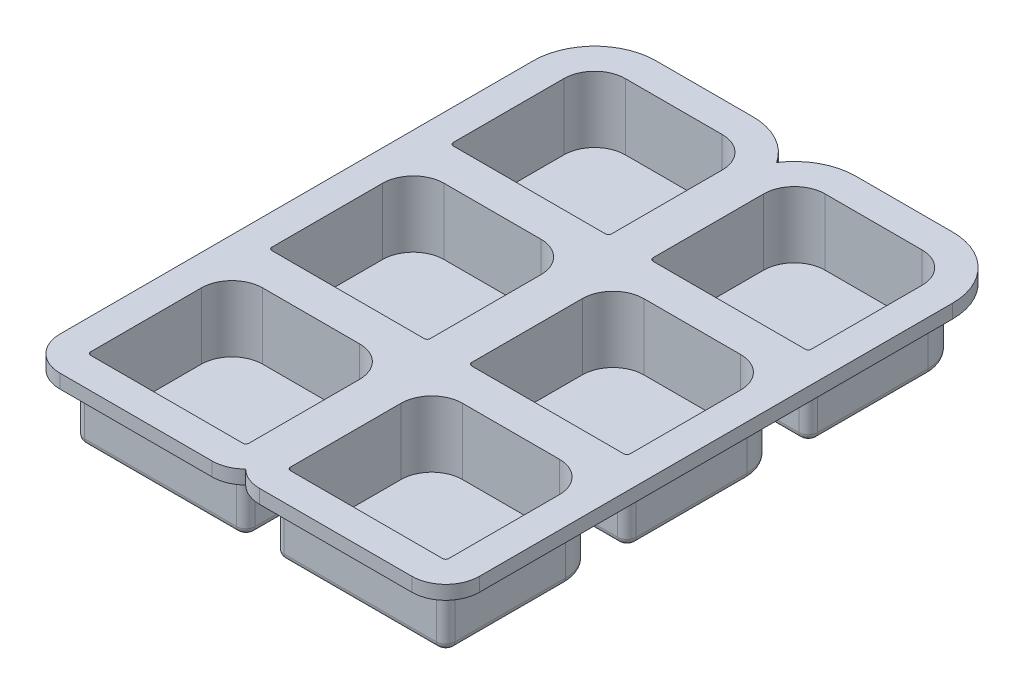
from build123d import *

# Parameters (mm, degrees)
SALIENTE_EXTRUIR1_DEPTH = 21.5
CORTAR_EXTRUIR1_DEPTH   = 17
SALIENTE_EXTRUIR2_START = 3
SALIENTE_EXTRUIR2_DEPTH = 3
REDONDEO2_R             = 2


with BuildPart() as part:
    # Croquis1 → Saliente-Extruir1 (new body)
    with BuildSketch(Plane(origin=(0, 0, 0), x_dir=(1, 0, 0), z_dir=(0, 1, 0))):
        with BuildLine():
            Line((-48.265, 92.5), (-16.735, 92.5))
            ThreePointArc((-16.735, 92.5), (-7.222745757, 90.093095783), (0, 83.451701923))
            ThreePointArc((0, 83.451701923), (7.222745757, 90.093095783), (16.735, 92.5))
            Line((16.735, 92.5), (48.265, 92.5))
            ThreePointArc((48.265, 92.5), (62.407135624, 86.642135624), (68.265, 72.5))
            Line((68.265, 72.5), (68.265, 36.5))
            Line((68.265, 36.5), (68.265, -45.5))
            Line((68.265, -45.5), (68.265, -81.5))
            ThreePointArc((68.265, -81.5), (65.043174593, -89.278174593), (57.265, -92.5))
            Line((57.265, -92.5), (7.735, -92.5))
            ThreePointArc((7.735, -92.5), (3.553625788, -91.674286692), (0, -89.321110855))
            ThreePointArc((0, -89.321110855), (-3.553625788, -91.674286692), (-7.735, -92.5))
            Line((-7.735, -92.5), (-57.265, -92.5))
            ThreePointArc((-57.265, -92.5), (-65.043174593, -89.278174593), (-68.265, -81.5))
            Line((-68.265, -81.5), (-68.265, -45.5))
            Line((-68.265, -45.5), (-68.265, 36.5))
            Line((-68.265, 36.5), (-68.265, 72.5))
            ThreePointArc((-68.265, 72.5), (-62.407135624, 86.642135624), (-48.265, 92.5))
        make_face()
        with BuildLine():
            Line((-48.265, 82.5), (-16.735, 82.5))
            ThreePointArc((-16.735, 82.5), (-9.663932188, 79.571067812), (-6.735, 72.5))
            Line((-6.735, 72.5), (-6.735, 36.5))
            ThreePointArc((-6.735, 36.5), (-7.027893219, 35.792893219), (-7.735, 35.5))
            Line((-7.735, 35.5), (-57.265, 35.5))
            ThreePointArc((-57.265, 35.5), (-57.972106781, 35.792893219), (-58.265, 36.5))
            Line((-58.265, 36.5), (-58.265, 72.5))
            ThreePointArc((-58.265, 72.5), (-55.336067812, 79.571067812), (-48.265, 82.5))
        make_face(mode=Mode.SUBTRACT)
        with BuildLine():
            Line((16.735, 82.5), (48.265, 82.5))
            ThreePointArc((48.265, 82.5), (55.336067812, 79.571067812), (58.265, 72.5))
            Line((58.265, 72.5), (58.265, 36.5))
            ThreePointArc((58.265, 36.5), (57.972106781, 35.792893219), (57.265, 35.5))
            Line((57.265, 35.5), (7.735, 35.5))
            ThreePointArc((7.735, 35.5), (7.027893219, 35.792893219), (6.735, 36.5))
            Line((6.735, 36.5), (6.735, 72.5))
            ThreePointArc((6.735, 72.5), (9.663932188, 79.571067812), (16.735, 82.5))
        make_face(mode=Mode.SUBTRACT)
        with BuildLine():
            Line((16.735, 23.5), (48.265, 23.5))
            ThreePointArc((48.265, 23.5), (55.336067812, 20.571067812), (58.265, 13.5))
            Line((58.265, 13.5), (58.265, -22.5))
            ThreePointArc((58.265, -22.5), (57.972106781, -23.207106781), (57.265, -23.5))
            Line((57.265, -23.5), (7.735, -23.5))
            ThreePointArc((7.735, -23.5), (7.027893219, -23.207106781), (6.735, -22.5))
            Line((6.735, -22.5), (6.735, 13.5))
            ThreePointArc((6.735, 13.5), (9.663932188, 20.571067812), (16.735, 23.5))
        make_face(mode=Mode.SUBTRACT)
        with BuildLine():
            Line((16.735, -35.5), (48.265, -35.5))
            ThreePointArc((48.265, -35.5), (55.336067812, -38.428932188), (58.265, -45.5))
            Line((58.265, -45.5), (58.265, -81.5))
            ThreePointArc((58.265, -81.5), (57.972106781, -82.207106781), (57.265, -82.5))
            Line((57.265, -82.5), (7.735, -82.5))
            ThreePointArc((7.735, -82.5), (7.027893219, -82.207106781), (6.735, -81.5))
            Line((6.735, -81.5), (6.735, -45.5))
            ThreePointArc((6.735, -45.5), (9.663932188, -38.428932188), (16.735, -35.5))
        make_face(mode=Mode.SUBTRACT)
        with BuildLine():
            Line((-48.265, 23.5), (-16.735, 23.5))
            ThreePointArc((-16.735, 23.5), (-9.663932188, 20.571067812), (-6.735, 13.5))
            Line((-6.735, 13.5), (-6.735, -22.5))
            ThreePointArc((-6.735, -22.5), (-7.027893219, -23.207106781), (-7.735, -23.5))
            Line((-7.735, -23.5), (-57.265, -23.5))
            ThreePointArc((-57.265, -23.5), (-57.972106781, -23.207106781), (-58.265, -22.5))
            Line((-58.265, -22.5), (-58.265, 13.5))
            ThreePointArc((-58.265, 13.5), (-55.336067812, 20.571067812), (-48.265, 23.5))
        make_face(mode=Mode.SUBTRACT)
        with BuildLine():
            Line((-48.265, -35.5), (-16.735, -35.5))
            ThreePointArc((-16.735, -35.5), (-9.663932188, -38.428932188), (-6.735, -45.5))
            Line((-6.735, -45.5), (-6.735, -81.5))
            ThreePointArc((-6.735, -81.5), (-7.027893219, -82.207106781), (-7.735, -82.5))
            Line((-7.735, -82.5), (-57.265, -82.5))
            ThreePointArc((-57.265, -82.5), (-57.972106781, -82.207106781), (-58.265, -81.5))
            Line((-58.265, -81.5), (-58.265, -45.5))
            ThreePointArc((-58.265, -45.5), (-55.336067812, -38.428932188), (-48.265, -35.5))
        make_face(mode=Mode.SUBTRACT)
    extrude(amount=SALIENTE_EXTRUIR1_DEPTH)

    # Croquis2 → Cortar-Extruir1 (cut)
    with BuildSketch(Plane.XZ):
        with BuildLine():
            Line((-48.265, -92.5), (-16.735, -92.5))
            ThreePointArc((-16.735, -92.5), (-7.222745757, -90.093095783), (0, -83.451701923))
            ThreePointArc((0, -83.451701923), (7.222745757, -90.093095783), (16.735, -92.5))
            Line((16.735, -92.5), (48.265, -92.5))
            ThreePointArc((48.265, -92.5), (62.407135624, -86.642135624), (68.265, -72.5))
            Line((68.265, -72.5), (68.265, 81.5))
            ThreePointArc((68.265, 81.5), (65.043174593, 89.278174593), (57.265, 92.5))
            Line((57.265, 92.5), (7.735, 92.5))
            ThreePointArc((7.735, 92.5), (3.553625788, 91.674286692), (0, 89.321110855))
            ThreePointArc((0, 89.321110855), (-3.553625788, 91.674286692), (-7.735, 92.5))
            Line((-7.735, 92.5), (-57.265, 92.5))
            ThreePointArc((-57.265, 92.5), (-65.043174593, 89.278174593), (-68.265, 81.5))
            Line((-68.265, 81.5), (-68.265, -72.5))
            ThreePointArc((-68.265, -72.5), (-62.407135624, -86.642135624), (-48.265, -92.5))
        make_face()
        with BuildLine():
            Line((60.265, -72.5), (60.265, -36.5))
            ThreePointArc((60.265, -36.5), (59.386320344, -34.378679656), (57.265, -33.5))
            Line((57.265, -33.5), (7.735, -33.5))
            ThreePointArc((7.735, -33.5), (5.613679656, -34.378679656), (4.735, -36.5))
            Line((4.735, -36.5), (4.735, -72.5))
            ThreePointArc((4.735, -72.5), (8.249718626, -80.985281374), (16.735, -84.5))
            Line((16.735, -84.5), (48.265, -84.5))
            ThreePointArc((48.265, -84.5), (56.750281374, -80.985281374), (60.265, -72.5))
        make_face(mode=Mode.SUBTRACT)
        with BuildLine():
            Line((-4.735, -72.5), (-4.735, -36.5))
            ThreePointArc((-4.735, -36.5), (-5.613679656, -34.378679656), (-7.735, -33.5))
            Line((-7.735, -33.5), (-57.265, -33.5))
            ThreePointArc((-57.265, -33.5), (-59.386320344, -34.378679656), (-60.265, -36.5))
            Line((-60.265, -36.5), (-60.265, -72.5))
            ThreePointArc((-60.265, -72.5), (-56.750281374, -80.985281374), (-48.265, -84.5))
            Line((-48.265, -84.5), (-16.735, -84.5))
            ThreePointArc((-16.735, -84.5), (-8.249718626, -80.985281374), (-4.735, -72.5))
        make_face(mode=Mode.SUBTRACT)
        with BuildLine():
            Line((-48.265, 33.5), (-16.735, 33.5))
            ThreePointArc((-16.735, 33.5), (-8.249718626, 37.014718626), (-4.735, 45.5))
            Line((-4.735, 45.5), (-4.735, 81.5))
            ThreePointArc((-4.735, 81.5), (-5.613679656, 83.621320344), (-7.735, 84.5))
            Line((-7.735, 84.5), (-57.265, 84.5))
            ThreePointArc((-57.265, 84.5), (-59.386320344, 83.621320344), (-60.265, 81.5))
            Line((-60.265, 81.5), (-60.265, 45.5))
            ThreePointArc((-60.265, 45.5), (-56.750281374, 37.014718626), (-48.265, 33.5))
        make_face(mode=Mode.SUBTRACT)
        with BuildLine():
            Line((16.735, 33.5), (48.265, 33.5))
            ThreePointArc((48.265, 33.5), (56.750281374, 37.014718626), (60.265, 45.5))
            Line((60.265, 45.5), (60.265, 81.5))
            ThreePointArc((60.265, 81.5), (59.386320344, 83.621320344), (57.265, 84.5))
            Line((57.265, 84.5), (7.735, 84.5))
            ThreePointArc((7.735, 84.5), (5.613679656, 83.621320344), (4.735, 81.5))
            Line((4.735, 81.5), (4.735, 45.5))
            ThreePointArc((4.735, 45.5), (8.249718626, 37.014718626), (16.735, 33.5))
        make_face(mode=Mode.SUBTRACT)
        with BuildLine():
            Line((-7.735, 25.5), (-57.265, 25.5))
            ThreePointArc((-57.265, 25.5), (-59.386320344, 24.621320344), (-60.265, 22.5))
            Line((-60.265, 22.5), (-60.265, -13.5))
            ThreePointArc((-60.265, -13.5), (-56.750281374, -21.985281374), (-48.265, -25.5))
            Line((-48.265, -25.5), (-16.735, -25.5))
            ThreePointArc((-16.735, -25.5), (-8.249718626, -21.985281374), (-4.735, -13.5))
            Line((-4.735, -13.5), (-4.735, 22.5))
            ThreePointArc((-4.735, 22.5), (-5.613679656, 24.621320344), (-7.735, 25.5))
        make_face(mode=Mode.SUBTRACT)
        with BuildLine():
            Line((57.265, 25.5), (7.735, 25.5))
            ThreePointArc((7.735, 25.5), (5.613679656, 24.621320344), (4.735, 22.5))
            Line((4.735, 22.5), (4.735, -13.5))
            ThreePointArc((4.735, -13.5), (8.249718626, -21.985281374), (16.735, -25.5))
            Line((16.735, -25.5), (48.265, -25.5))
            ThreePointArc((48.265, -25.5), (56.750281374, -21.985281374), (60.265, -13.5))
            Line((60.265, -13.5), (60.265, 22.5))
            ThreePointArc((60.265, 22.5), (59.386320344, 24.621320344), (57.265, 25.5))
        make_face(mode=Mode.SUBTRACT)
    extrude(amount=-CORTAR_EXTRUIR1_DEPTH, mode=Mode.SUBTRACT)

    # Croquis3 → Saliente-Extruir2 (add)
    with BuildSketch(Plane.XZ.offset(SALIENTE_EXTRUIR2_START)):
        with BuildLine():
            Line((60.265, 45.5), (60.265, 81.5))
            ThreePointArc((60.265, 81.5), (59.386320344, 83.621320344), (57.265, 84.5))
            Line((57.265, 84.5), (7.735, 84.5))
            ThreePointArc((7.735, 84.5), (5.613679656, 83.621320344), (4.735, 81.5))
            Line((4.735, 81.5), (4.735, 45.5))
            ThreePointArc((4.735, 45.5), (8.249718626, 37.014718626), (16.735, 33.5))
            Line((16.735, 33.5), (48.265, 33.5))
            ThreePointArc((48.265, 33.5), (56.750281374, 37.014718626), (60.265, 45.5))
        make_face()
        with BuildLine():
            Line((-48.265, 33.5), (-16.735, 33.5))
            ThreePointArc((-16.735, 33.5), (-8.249718626, 37.014718626), (-4.735, 45.5))
            Line((-4.735, 45.5), (-4.735, 81.5))
            ThreePointArc((-4.735, 81.5), (-5.613679656, 83.621320344), (-7.735, 84.5))
            Line((-7.735, 84.5), (-57.265, 84.5))
            ThreePointArc((-57.265, 84.5), (-59.386320344, 83.621320344), (-60.265, 81.5))
            Line((-60.265, 81.5), (-60.265, 45.5))
            ThreePointArc((-60.265, 45.5), (-56.750281374, 37.014718626), (-48.265, 33.5))
        make_face()
        with BuildLine():
            Line((-7.735, 25.5), (-57.265, 25.5))
            ThreePointArc((-57.265, 25.5), (-59.386320344, 24.621320344), (-60.265, 22.5))
            Line((-60.265, 22.5), (-60.265, -13.5))
            ThreePointArc((-60.265, -13.5), (-56.750281374, -21.985281374), (-48.265, -25.5))
            Line((-48.265, -25.5), (-16.735, -25.5))
            ThreePointArc((-16.735, -25.5), (-8.249718626, -21.985281374), (-4.735, -13.5))
            Line((-4.735, -13.5), (-4.735, 22.5))
            ThreePointArc((-4.735, 22.5), (-5.613679656, 24.621320344), (-7.735, 25.5))
        make_face()
        with BuildLine():
            Line((57.265, 25.5), (7.735, 25.5))
            ThreePointArc((7.735, 25.5), (5.613679656, 24.621320344), (4.735, 22.5))
            Line((4.735, 22.5), (4.735, -13.5))
            ThreePointArc((4.735, -13.5), (8.249718626, -21.985281374), (16.735, -25.5))
            Line((16.735, -25.5), (48.265, -25.5))
            ThreePointArc((48.265, -25.5), (56.750281374, -21.985281374), (60.265, -13.5))
            Line((60.265, -13.5), (60.265, 22.5))
            ThreePointArc((60.265, 22.5), (59.386320344, 24.621320344), (57.265, 25.5))
        make_face()
        with BuildLine():
            Line((-7.735, -33.5), (-57.265, -33.5))
            ThreePointArc((-57.265, -33.5), (-59.386320344, -34.378679656), (-60.265, -36.5))
            Line((-60.265, -36.5), (-60.265, -72.5))
            ThreePointArc((-60.265, -72.5), (-56.750281374, -80.985281374), (-48.265, -84.5))
            Line((-48.265, -84.5), (-16.735, -84.5))
            ThreePointArc((-16.735, -84.5), (-8.249718626, -80.985281374), (-4.735, -72.5))
            Line((-4.735, -72.5), (-4.735, -36.5))
            ThreePointArc((-4.735, -36.5), (-5.613679656, -34.378679656), (-7.735, -33.5))
        make_face()
        with BuildLine():
            Line((60.265, -72.5), (60.265, -36.5))
            ThreePointArc((60.265, -36.5), (59.386320344, -34.378679656), (57.265, -33.5))
            Line((57.265, -33.5), (7.735, -33.5))
            ThreePointArc((7.735, -33.5), (5.613679656, -34.378679656), (4.735, -36.5))
            Line((4.735, -36.5), (4.735, -72.5))
            ThreePointArc((4.735, -72.5), (8.249718626, -80.985281374), (16.735, -84.5))
            Line((16.735, -84.5), (48.265, -84.5))
            ThreePointArc((48.265, -84.5), (56.750281374, -80.985281374), (60.265, -72.5))
        make_face()
    extrude(amount=-SALIENTE_EXTRUIR2_DEPTH)

    # Redondeo2
    redondeo2_edges = [part.edges().sort_by_distance(p)[0] for p in [
        (-4.735, 17, -54.5),
        (-5.613679656, 17, -34.378679656),
        (-32.5, 17, -33.5),
        (-59.386320344, 17, -34.378679656),
        (-60.265, 17, -54.5),
        (-56.750281374, 17, -80.985281374),
        (-32.5, 17, -84.5),
        (-8.249718626, 17, -80.985281374),
        (-60.265, 17, 63.5),
        (-56.750281374, 17, 37.014718626),
        (-32.5, 17, 33.5),
        (-8.249718626, 17, 37.014718626),
        (-4.735, 17, 63.5),
        (-5.613679656, 17, 83.621320344),
        (-32.5, 17, 84.5),
        (-59.386320344, 17, 83.621320344),
        (60.265, 17, 4.5),
        (59.386320344, 17, 24.621320344),
        (32.5, 17, 25.5),
        (5.613679656, 17, 24.621320344),
        (4.735, 17, 4.5),
        (8.249718626, 17, -21.985281374),
        (32.5, 17, -25.5),
        (56.750281374, 17, -21.985281374),
        (32.5, 17, 33.5),
        (56.750281374, 17, 37.014718626),
        (60.265, 17, 63.5),
        (59.386320344, 17, 83.621320344),
        (32.5, 17, 84.5),
        (5.613679656, 17, 83.621320344),
        (4.735, 17, 63.5),
        (8.249718626, 17, 37.014718626),
        (-4.735, 17, 4.5),
        (-5.613679656, 17, 24.621320344),
        (-32.5, 17, 25.5),
        (-59.386320344, 17, 24.621320344),
        (-60.265, 17, 4.5),
        (-56.750281374, 17, -21.985281374),
        (-32.5, 17, -25.5),
        (-8.249718626, 17, -21.985281374),
        (32.5, 17, -84.5),
        (56.750281374, 17, -80.985281374),
        (60.265, 17, -54.5),
        (59.386320344, 17, -34.378679656),
        (32.5, 17, -33.5),
        (5.613679656, 17, -34.378679656),
        (4.735, 17, -54.5),
        (8.249718626, 17, -80.985281374),
        (-5.613679656, -3, -34.378679656),
        (-32.5, -3, -33.5),
        (-59.386320344, -3, -34.378679656),
        (-60.265, -3, -54.5),
        (-56.750281374, -3, -80.985281374),
        (-32.5, -3, -84.5),
        (-8.249718626, -3, -80.985281374),
        (-4.735, -3, -54.5),
        (59.386320344, -3, 24.621320344),
        (32.5, -3, 25.5),
        (5.613679656, -3, 24.621320344),
        (4.735, -3, 4.5),
        (8.249718626, -3, -21.985281374),
        (32.5, -3, -25.5),
        (56.750281374, -3, -21.985281374),
        (60.265, -3, 4.5),
        (-5.613679656, -3, 24.621320344),
        (-32.5, -3, 25.5),
        (-59.386320344, -3, 24.621320344),
        (-60.265, -3, 4.5),
        (-56.750281374, -3, -21.985281374),
        (-32.5, -3, -25.5),
        (-8.249718626, -3, -21.985281374),
        (-4.735, -3, 4.5),
        (-56.750281374, -3, 37.014718626),
        (-32.5, -3, 33.5),
        (-8.249718626, -3, 37.014718626),
        (-4.735, -3, 63.5),
        (-5.613679656, -3, 83.621320344),
        (-32.5, -3, 84.5),
        (-59.386320344, -3, 83.621320344),
        (-60.265, -3, 63.5),
        (56.750281374, -3, -80.985281374),
        (60.265, -3, -54.5),
        (59.386320344, -3, -34.378679656),
        (32.5, -3, -33.5),
        (5.613679656, -3, -34.378679656),
        (4.735, -3, -54.5),
        (8.249718626, -3, -80.985281374),
        (32.5, -3, -84.5),
        (56.750281374, -3, 37.014718626),
        (60.265, -3, 63.5),
        (59.386320344, -3, 83.621320344),
        (32.5, -3, 84.5),
        (5.613679656, -3, 83.621320344),
        (4.735, -3, 63.5),
        (8.249718626, -3, 37.014718626),
        (32.5, -3, 33.5),
    ]]
    fillet(redondeo2_edges, radius=REDONDEO2_R)


solid = part.part
